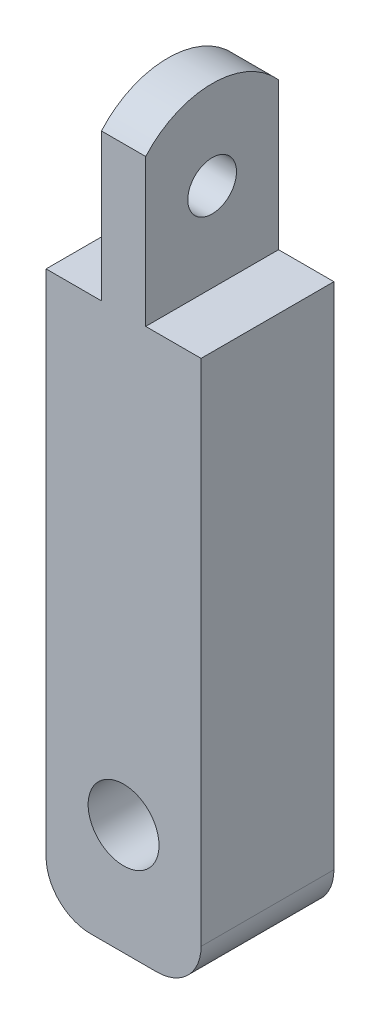
from build123d import *

# Parameters (mm, degrees)
BOSS_EXTRUDE1_DEPTH = 6
SKETCH2_R           = 1.6
CUT_EXTRUDE1_DEPTH  = 22.644860822
CUT_EXTRUDE2_DEPTH  = 2.5
SKETCH4_R           = 1.1
CUT_EXTRUDE3_DEPTH  = 22.828879953
CUT_EXTRUDE4_DEPTH  = 22.828879953
FILLET1_R           = 2


with BuildPart() as part:
    # Sketch1 → Boss-Extrude1 (new body)
    with BuildSketch(Plane.XY):
        Polygon((-1, 12.5), (-1, 20.5), (1, 20.5), (1, 12.5), (3.5, 12.5), (3.5, -12.5), (-3.5, -12.5), (-3.5, 12.5), align=None)
    extrude(amount=BOSS_EXTRUDE1_DEPTH)

    # Sketch2 → Cut-Extrude1 (cut, through all)
    with BuildSketch(Plane.XY.offset(6)):
        with Locations((0, -7.5)):
            Circle(SKETCH2_R)
    extrude(amount=-CUT_EXTRUDE1_DEPTH, mode=Mode.SUBTRACT)

    # Sketch3 → Cut-Extrude2 (cut)
    with BuildSketch(Plane(origin=(0, 0, 0), x_dir=(-1, 0, 0), z_dir=(0, 0, -1))):
        Polygon((0, -4.295706006), (-2.775, -5.897853003), (-2.775, -9.102146997), (0, -10.704293994), (2.775, -9.102146997), (2.775, -5.897853003), align=None)
    extrude(amount=-CUT_EXTRUDE2_DEPTH, mode=Mode.SUBTRACT)

    # Sketch4 → Cut-Extrude3 (cut, through all)
    with BuildSketch(Plane.ZY.offset(1)):
        with Locations(Location((3, 16.5, 0), (0, 0, 270))):
            Circle(SKETCH4_R)
    extrude(amount=-CUT_EXTRUDE3_DEPTH, mode=Mode.SUBTRACT)

    # Sketch5 → Cut-Extrude4 (cut, through all)
    with BuildSketch(Plane.ZY.offset(1)):
        with BuildLine():
            Line((6, 20.5), (3, 20.5))
            ThreePointArc((3, 20.5), (4.645751311, 20.145751311), (6, 19.145751311))
            Line((6, 19.145751311), (6, 20.5))
        make_face()
        with BuildLine():
            Line((0, 20.5), (0, 19.145751311))
            ThreePointArc((0, 19.145751311), (1.354248689, 20.145751311), (3, 20.5))
            Line((3, 20.5), (0, 20.5))
        make_face()
    extrude(amount=-CUT_EXTRUDE4_DEPTH, mode=Mode.SUBTRACT)

    # Fillet1
    fillet1_edges = [part.edges().sort_by_distance(p)[0] for p in [
        (3.5, -12.5, 3),
        (-3.5, -12.5, 3),
    ]]
    fillet(fillet1_edges, radius=FILLET1_R)


solid = part.part
